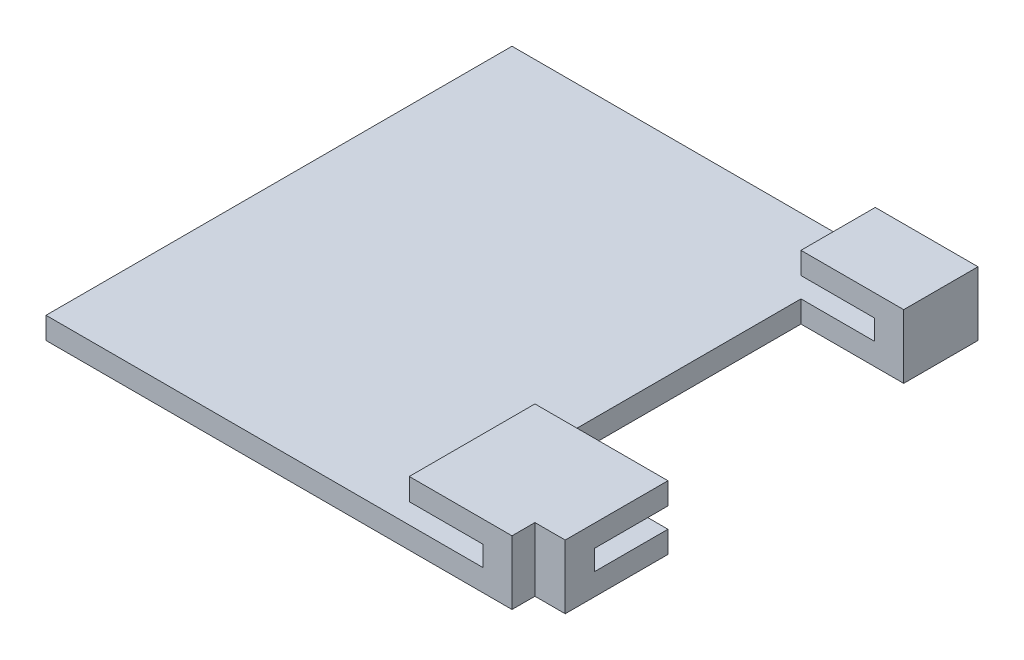
from build123d import *

# Parameters (mm, degrees)
BOSS_EXTRUDE1_DEPTH = 25.4
SKETCH2_W           = 11.199999952
SKETCH2_H           = 23.399999936
SKETCH2_H_2         = 5.599999976
CUT_EXTRUDE1_DEPTH  = 48.558347416
BOSS_EXTRUDE2_DEPTH = 3.302
SKETCH4_W           = 3.175
SKETCH4_H           = 2.199999918
CUT_EXTRUDE2_DEPTH  = 8.024999952


with BuildPart() as part:
    # Sketch1 → Boss-Extrude1 (new, symmetric)
    with BuildSketch(Plane.XY):
        Polygon((0, 0), (8.024999952, 0), (8.024999952, -2.199999918), (-39.600000048, -2.199999918), (-39.600000048, -4.581249918), (11.199999952, -4.581249918), (11.199999952, 2.38125), (0, 2.38125), align=None)
    extrude(amount=BOSS_EXTRUDE1_DEPTH, both=True)

    # Sketch2 → Cut-Extrude1 (cut, through all)
    with BuildSketch(Plane(origin=(0, 2.38125, 0), x_dir=(1, 0, 0), z_dir=(0, 1, 0))):
        with Locations((5.599999976, 0)):
            Rectangle(SKETCH2_W, SKETCH2_H)
        with Locations((5.599999976, 14.499999956)):
            Rectangle(SKETCH2_W, SKETCH2_H_2)
    extrude(amount=-CUT_EXTRUDE1_DEPTH, mode=Mode.SUBTRACT)

    # Sketch3 → Boss-Extrude2 (add)
    with BuildSketch(Plane.ZY.offset(-11.199999952)):
        Polygon((22.89999992, 0), (19.72499992, 0), (19.72499992, -2.199999918), (11.699999968, -2.199999918), (11.699999968, -4.581249918), (22.89999992, -4.581249918), align=None)
        Polygon((11.699999968, 2.38125), (11.699999968, 0), (19.72499992, 0), (22.89999992, 0), (22.89999992, 2.38125), align=None)
    extrude(amount=-BOSS_EXTRUDE2_DEPTH)

    # Sketch4 → Cut-Extrude2 (cut)
    with BuildSketch(Plane(origin=(0, 0, 11.699999968), x_dir=(-1, 0, 0), z_dir=(0, 0, -1))):
        with Locations((-9.612499952, -1.099999959)):
            Rectangle(SKETCH4_W, SKETCH4_H)
    extrude(amount=-CUT_EXTRUDE2_DEPTH, mode=Mode.SUBTRACT)


solid = part.part
